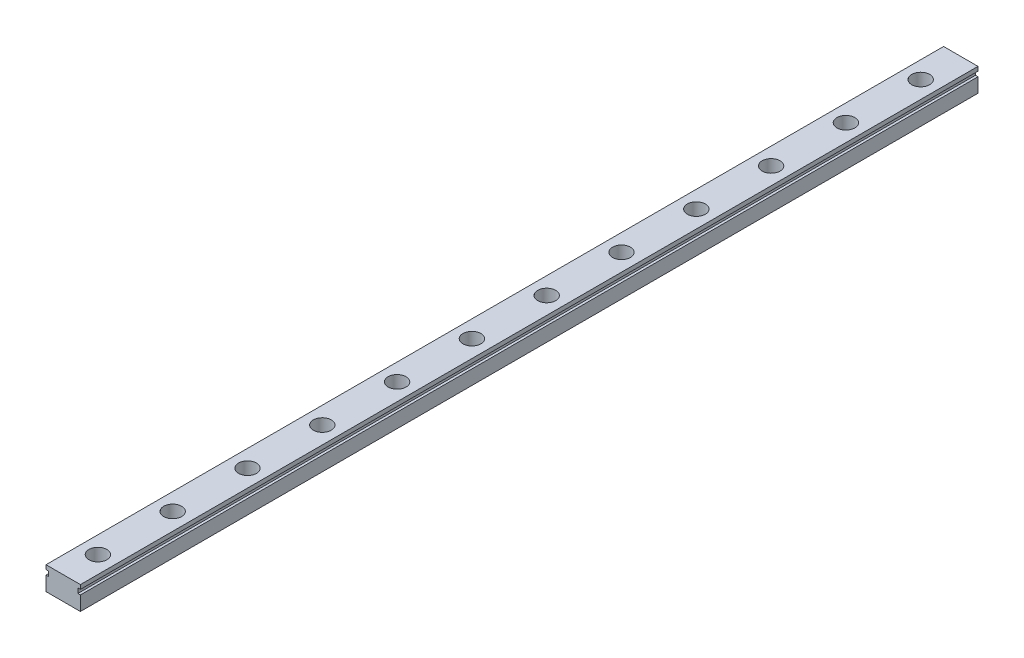
from build123d import *

# Parameters (mm, degrees)
SKETCH1_W           = 11.5
SKETCH1_H           = 7.8
BOSS_EXTRUDE1_DEPTH = 300
SKETCH2_W           = 0.835250229
SKETCH2_H           = 1.6
CUT_EXTRUDE1_DEPTH  = 301.080443381
SKETCH3_R           = 3
CUT_EXTRUDE2_DEPTH  = 4.7
SKETCH4_R           = 1.7
CUT_EXTRUDE3_DEPTH  = 301.091906755


with BuildPart() as part:
    # Sketch1 → Boss-Extrude1 (new body)
    with BuildSketch(Plane.XY):
        Rectangle(SKETCH1_W, SKETCH1_H)
    extrude(amount=BOSS_EXTRUDE1_DEPTH)

    # Sketch2 → Cut-Extrude1 (cut, through all)
    with BuildSketch(Plane.XY.offset(300)):
        with Locations((5.332374886, 1.7)):
            Rectangle(SKETCH2_W, SKETCH2_H)
        with Locations((-5.332374886, 1.7)):
            Rectangle(SKETCH2_W, SKETCH2_H)
    extrude(amount=-CUT_EXTRUDE1_DEPTH, mode=Mode.SUBTRACT)

    # Sketch3 → Cut-Extrude2 (cut)
    with BuildSketch(Plane(origin=(0, 3.9, 0), x_dir=(1, 0, 0), z_dir=(0, 1, 0))):
        with Locations(Location((0, -288.4, 0), (0, 0, 270))):
            Circle(SKETCH3_R)
        with Locations(Location((0, -263.4, 0), (0, 0, 270))):
            Circle(SKETCH3_R)
        with Locations(Location((0, -238.4, 0), (0, 0, 270))):
            Circle(SKETCH3_R)
        with Locations(Location((0, -213.4, 0), (0, 0, 270))):
            Circle(SKETCH3_R)
        with Locations(Location((0, -188.4, 0), (0, 0, 270))):
            Circle(SKETCH3_R)
        with Locations(Location((0, -163.4, 0), (0, 0, 270))):
            Circle(SKETCH3_R)
        with Locations(Location((0, -138.4, 0), (0, 0, 270))):
            Circle(SKETCH3_R)
        with Locations(Location((0, -113.4, 0), (0, 0, 270))):
            Circle(SKETCH3_R)
        with Locations(Location((0, -88.4, 0), (0, 0, 270))):
            Circle(SKETCH3_R)
        with Locations(Location((0, -63.4, 0), (0, 0, 270))):
            Circle(SKETCH3_R)
        with Locations(Location((0, -38.4, 0), (0, 0, 270))):
            Circle(SKETCH3_R)
        with Locations(Location((0, -13.4, 0), (0, 0, 270))):
            Circle(SKETCH3_R)
        with Locations((0, 11.6)):
            Circle(SKETCH3_R)
        with Locations((0, 36.6)):
            Circle(SKETCH3_R)
        with Locations((0, 61.6)):
            Circle(SKETCH3_R)
        with Locations((0, 86.6)):
            Circle(SKETCH3_R)
        with Locations((0, 111.6)):
            Circle(SKETCH3_R)
        with Locations((0, 136.6)):
            Circle(SKETCH3_R)
        with Locations((0, 161.6)):
            Circle(SKETCH3_R)
        with Locations((0, 186.6)):
            Circle(SKETCH3_R)
        with Locations((0, 211.6)):
            Circle(SKETCH3_R)
        with Locations((0, 236.6)):
            Circle(SKETCH3_R)
        with Locations((0, 261.6)):
            Circle(SKETCH3_R)
        with Locations((0, 286.6)):
            Circle(SKETCH3_R)
        with Locations((0, 311.6)):
            Circle(SKETCH3_R)
        with Locations((0, 336.6)):
            Circle(SKETCH3_R)
        with Locations((0, 361.6)):
            Circle(SKETCH3_R)
        with Locations((0, 386.6)):
            Circle(SKETCH3_R)
        with Locations((0, 411.6)):
            Circle(SKETCH3_R)
        with Locations((0, 436.6)):
            Circle(SKETCH3_R)
    extrude(amount=-CUT_EXTRUDE2_DEPTH, mode=Mode.SUBTRACT)

    # Sketch4 → Cut-Extrude3 (cut, through all)
    with BuildSketch(Plane(origin=(0, -0.8, 0), x_dir=(1, 0, 0), z_dir=(0, 1, 0))):
        with Locations(Location((0, -288.4, 0), (0, 0, 270))):
            Circle(SKETCH4_R)
        with Locations(Location((0, -263.4, 0), (0, 0, 270))):
            Circle(SKETCH4_R)
        with Locations(Location((0, -238.4, 0), (0, 0, 270))):
            Circle(SKETCH4_R)
        with Locations(Location((0, -213.4, 0), (0, 0, 270))):
            Circle(SKETCH4_R)
        with Locations(Location((0, -188.4, 0), (0, 0, 270))):
            Circle(SKETCH4_R)
        with Locations(Location((0, -163.4, 0), (0, 0, 270))):
            Circle(SKETCH4_R)
        with Locations(Location((0, -138.4, 0), (0, 0, 270))):
            Circle(SKETCH4_R)
        with Locations(Location((0, -113.4, 0), (0, 0, 270))):
            Circle(SKETCH4_R)
        with Locations(Location((0, -88.4, 0), (0, 0, 270))):
            Circle(SKETCH4_R)
        with Locations(Location((0, -63.4, 0), (0, 0, 270))):
            Circle(SKETCH4_R)
        with Locations(Location((0, -38.4, 0), (0, 0, 270))):
            Circle(SKETCH4_R)
        with Locations(Location((0, -13.4, 0), (0, 0, 270))):
            Circle(SKETCH4_R)
        with Locations((0, 11.6)):
            Circle(SKETCH4_R)
        with Locations((0, 36.6)):
            Circle(SKETCH4_R)
        with Locations((0, 61.6)):
            Circle(SKETCH4_R)
        with Locations((0, 86.6)):
            Circle(SKETCH4_R)
        with Locations((0, 111.6)):
            Circle(SKETCH4_R)
        with Locations((0, 136.6)):
            Circle(SKETCH4_R)
        with Locations((0, 161.6)):
            Circle(SKETCH4_R)
        with Locations((0, 186.6)):
            Circle(SKETCH4_R)
        with Locations((0, 211.6)):
            Circle(SKETCH4_R)
        with Locations((0, 236.6)):
            Circle(SKETCH4_R)
        with Locations((0, 261.6)):
            Circle(SKETCH4_R)
        with Locations((0, 286.6)):
            Circle(SKETCH4_R)
        with Locations((0, 311.6)):
            Circle(SKETCH4_R)
        with Locations((0, 336.6)):
            Circle(SKETCH4_R)
        with Locations((0, 361.6)):
            Circle(SKETCH4_R)
        with Locations((0, 386.6)):
            Circle(SKETCH4_R)
        with Locations((0, 411.6)):
            Circle(SKETCH4_R)
        with Locations((0, 436.6)):
            Circle(SKETCH4_R)
    extrude(amount=-CUT_EXTRUDE3_DEPTH, mode=Mode.SUBTRACT)


solid = part.part
